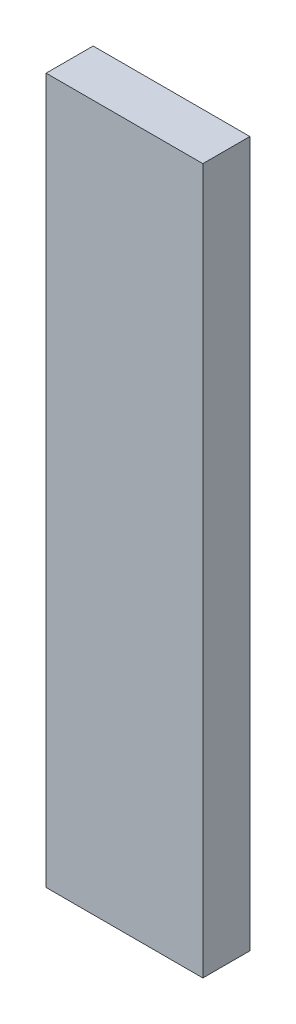
from build123d import *

# Parameters (mm, degrees)
SKETCH2_W           = 100
SKETCH2_H           = 450
BOSS_EXTRUDE1_DEPTH = 30


with BuildPart() as part:
    # Sketch2 → Boss-Extrude1 (new body)
    with BuildSketch(Plane.XY):
        with Locations((50, 225)):
            Rectangle(SKETCH2_W, SKETCH2_H)
    extrude(amount=BOSS_EXTRUDE1_DEPTH)


solid = part.part
